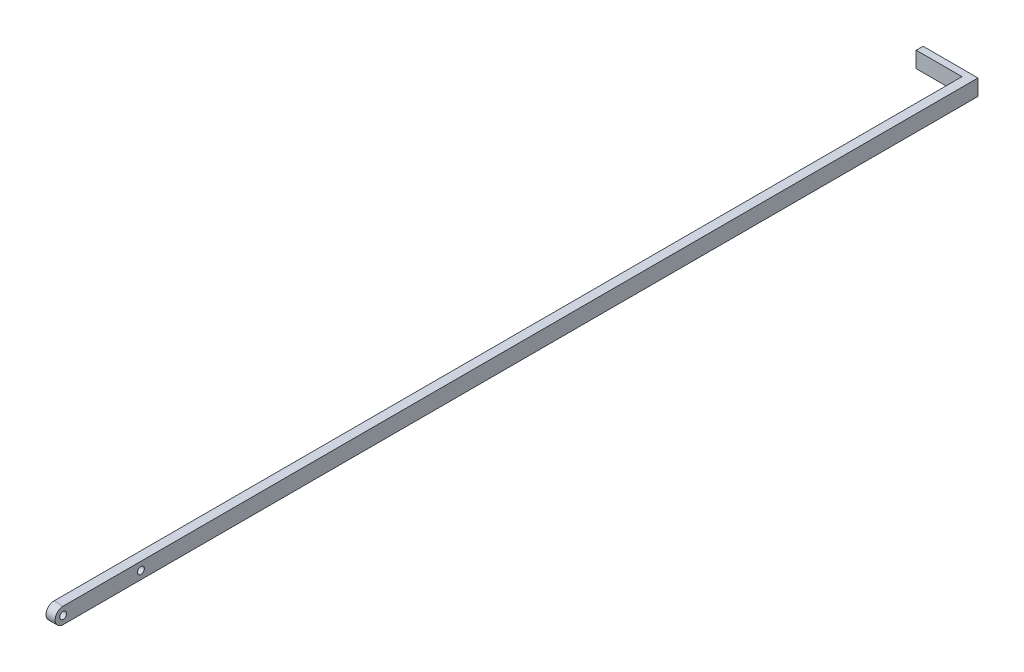
from build123d import *

# Parameters (mm, degrees)
SKETCH_1_R      = 1.5
EXTRUDE_1_DEPTH = 4
SKETCH_2_W      = 20
SKETCH_2_H      = 7
EXTRUDE_2_DEPTH = 3


with BuildPart() as part:
    # 草图1 → 凸台-拉伸1 (new body)
    with BuildSketch(Plane(origin=(0, 0, 0), x_dir=(0, 0, -1), z_dir=(1, 0, 0))):
        with BuildLine():
            Line((400, 7), (400, 0))
            Line((400, 0), (0, 0))
            ThreePointArc((0, 0), (-3.5, 3.5), (0, 7))
            Line((0, 7), (400, 7))
        make_face()
        with Locations((0, 3.5)):
            Circle(SKETCH_1_R, mode=Mode.SUBTRACT)
        with Locations((34, 3.5)):
            Circle(SKETCH_1_R, mode=Mode.SUBTRACT)
    extrude(amount=EXTRUDE_1_DEPTH)

    # 草图2 → 凸台-拉伸2 (add)
    with BuildSketch(Plane(origin=(0, 0, -400), x_dir=(-1, 0, 0), z_dir=(0, 0, -1))):
        with Locations((10, 3.5)):
            Rectangle(SKETCH_2_W, SKETCH_2_H)
    extrude(amount=-EXTRUDE_2_DEPTH)


solid = part.part
